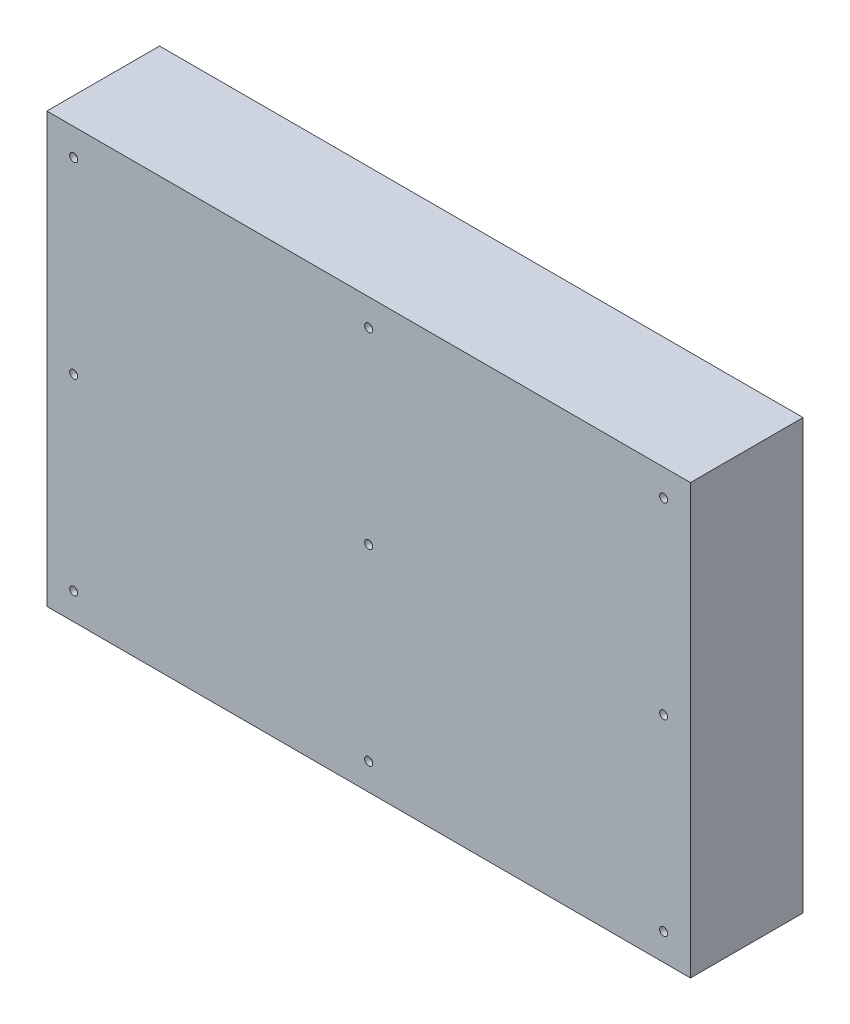
from build123d import *

# Parameters (mm, degrees)
SKETCH1_W           = 240
SKETCH1_H           = 160
BOSS_EXTRUDE1_DEPTH = 2
SKETCH5_R           = 1.5
CUT_EXTRUDE2_DEPTH  = 4
SKETCH6_W           = 240
SKETCH6_H           = 160
SKETCH6_W_2         = 237
SKETCH6_H_2         = 157
BOSS_EXTRUDE2_DEPTH = 40
SKETCH7_W           = 7
SKETCH7_H           = 7
BOSS_EXTRUDE3_DEPTH = 40
SKETCH8_R           = 2.9
CUT_EXTRUDE3_DEPTH  = 6.2


with BuildPart() as part:
    # Sketch1 → Boss-Extrude1 (new body)
    with BuildSketch(Plane.XY):
        Rectangle(SKETCH1_W, SKETCH1_H)
    extrude(amount=BOSS_EXTRUDE1_DEPTH)

    # Sketch5 → Cut-Extrude2 (cut)
    with BuildSketch(Plane.XY.offset(2)):
        with Locations((-110, 70)):
            Circle(SKETCH5_R)
        with Locations((0, 70)):
            Circle(SKETCH5_R)
        with Locations((110, 70)):
            Circle(SKETCH5_R)
        Circle(SKETCH5_R)
        with Locations((110, 0)):
            Circle(SKETCH5_R)
        with Locations((0, -70)):
            Circle(SKETCH5_R)
        with Locations((110, -70)):
            Circle(SKETCH5_R)
        with Locations((-110, 0)):
            Circle(SKETCH5_R)
        with Locations((-110, -70)):
            Circle(SKETCH5_R)
    extrude(amount=-CUT_EXTRUDE2_DEPTH, mode=Mode.SUBTRACT)

    # Sketch6 → Boss-Extrude2 (add)
    with BuildSketch(Plane(origin=(0, 0, 0), x_dir=(-1, 0, 0), z_dir=(0, 0, -1))):
        Rectangle(SKETCH6_W, SKETCH6_H)
        Rectangle(SKETCH6_W_2, SKETCH6_H_2, mode=Mode.SUBTRACT)
    extrude(amount=BOSS_EXTRUDE2_DEPTH)

    # Sketch7 → Boss-Extrude3 (add)
    with BuildSketch(Plane(origin=(0, 0, 0), x_dir=(-1, 0, 0), z_dir=(0, 0, -1))):
        with Locations((115, -75)):
            Rectangle(SKETCH7_W, SKETCH7_H)
        with Locations((115, 75)):
            Rectangle(SKETCH7_W, SKETCH7_H)
        with Locations((-115, 75)):
            Rectangle(SKETCH7_W, SKETCH7_H)
        with Locations((-115, -75)):
            Rectangle(SKETCH7_W, SKETCH7_H)
    extrude(amount=BOSS_EXTRUDE3_DEPTH)

    # Sketch8 → Cut-Extrude3 (cut)
    with BuildSketch(Plane(origin=(0, 0, -40), x_dir=(-1, 0, 0), z_dir=(0, 0, -1))):
        with Locations((116, -76)):
            Circle(SKETCH8_R)
        with Locations((116, 76)):
            Circle(SKETCH8_R)
        with Locations((-116, 76)):
            Circle(SKETCH8_R)
        with Locations((-116, -76)):
            Circle(SKETCH8_R)
    extrude(amount=-CUT_EXTRUDE3_DEPTH, mode=Mode.SUBTRACT)


solid = part.part
